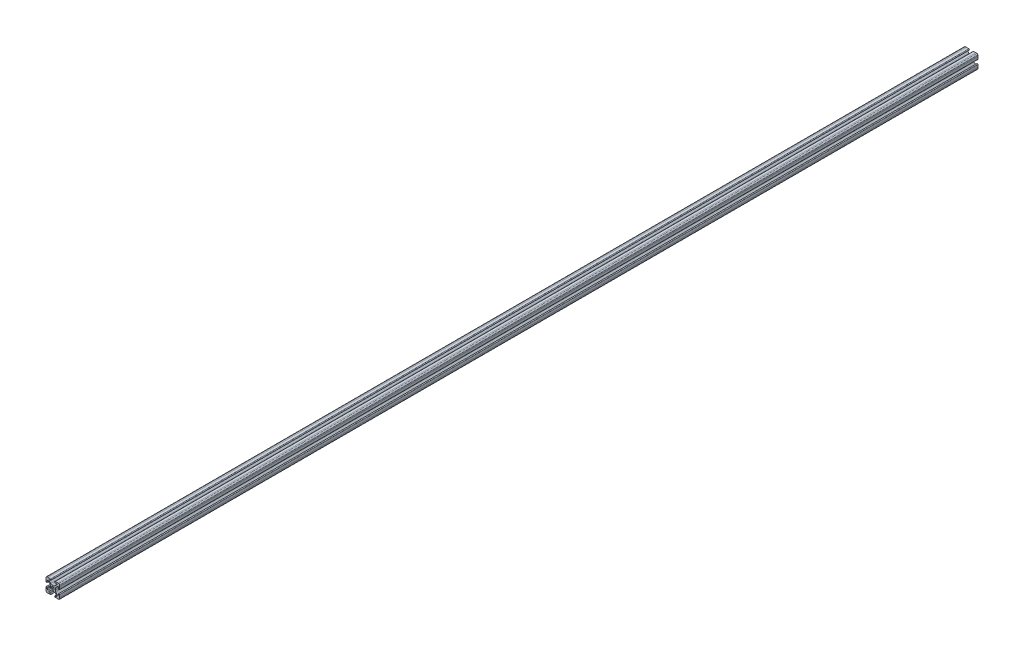
from build123d import *

# Parameters (mm, degrees)
BOSS_EXTRUDE1_DEPTH = 1675.384


with BuildPart() as part:
    # Model → Boss-Extrude1 (new body)
    with BuildSketch(Plane.XY):
        with BuildLine():
            Line((50.659960212, 72.999871414), (53.774553856, 72.999871414))
            ThreePointArc((53.774553856, 72.999871414), (54.989573754, 72.758188929), (56.019617887, 72.069935444))
            Line((56.019617887, 72.069935444), (59.264200891, 68.825352439))
            ThreePointArc((59.264200891, 68.825352439), (59.477513437, 67.701802895), (58.510322513, 67.091550869))
            Line((58.510322513, 67.091550869), (56.572487817, 67.159221548))
            ThreePointArc((56.572487817, 67.159221548), (55.4691069, 66.130302197), (56.498026251, 65.026921279))
            Line((56.498026251, 65.026921279), (60.677257034, 64.880979325))
            Line((60.677257034, 64.880979325), (62.710657034, 64.880979325))
            ThreePointArc((62.710657034, 64.880979325), (64.129537501, 65.468698857), (64.717257034, 66.887579325))
            Line((64.717257034, 66.887579325), (64.717257034, 68.920979325))
            Line((64.717257034, 68.920979325), (64.57131508, 73.100210108))
            ThreePointArc((64.57131508, 73.100210108), (63.467934162, 74.129129459), (62.439014811, 73.025748542))
            Line((62.439014811, 73.025748542), (62.50668549, 71.087913846))
            ThreePointArc((62.50668549, 71.087913846), (61.896433464, 70.120722922), (60.77288392, 70.334035468))
            Line((60.77288392, 70.334035468), (57.528300915, 73.578618472))
            ThreePointArc((57.528300915, 73.578618472), (56.84004743, 74.608662605), (56.598364945, 75.823682503))
            Line((56.598364945, 75.823682503), (56.598364945, 78.938276147))
            ThreePointArc((56.598364945, 78.938276147), (56.84004743, 80.153296044), (57.528300915, 81.183340177))
            Line((57.528300915, 81.183340177), (60.77288392, 84.427923182))
            ThreePointArc((60.77288392, 84.427923182), (61.896433464, 84.641235728), (62.50668549, 83.674044803))
            Line((62.50668549, 83.674044803), (62.439014811, 81.736210108))
            ThreePointArc((62.439014811, 81.736210108), (63.467934162, 80.63282919), (64.57131508, 81.661748542))
            Line((64.57131508, 81.661748542), (64.717257034, 85.840979325))
            Line((64.717257034, 85.840979325), (64.717257034, 87.874379325))
            ThreePointArc((64.717257034, 87.874379325), (64.129537501, 89.293259792), (62.710657034, 89.880979325))
            Line((62.710657034, 89.880979325), (60.677257034, 89.880979325))
            Line((60.677257034, 89.880979325), (56.498026251, 89.73503737))
            ThreePointArc((56.498026251, 89.73503737), (55.4691069, 88.631656452), (56.572487817, 87.602737101))
            Line((56.572487817, 87.602737101), (58.510322513, 87.67040778))
            ThreePointArc((58.510322513, 87.67040778), (59.477513437, 87.060155754), (59.264200891, 85.93660621))
            Line((59.264200891, 85.93660621), (56.019617887, 82.692023205))
            ThreePointArc((56.019617887, 82.692023205), (54.989573754, 82.00376972), (53.774553856, 81.762087236))
            Line((53.774553856, 81.762087236), (50.659960212, 81.762087236))
            ThreePointArc((50.659960212, 81.762087236), (49.444940315, 82.00376972), (48.414896182, 82.692023205))
            Line((48.414896182, 82.692023205), (45.170313177, 85.93660621))
            ThreePointArc((45.170313177, 85.93660621), (44.957000631, 87.060155754), (45.924191556, 87.67040778))
            Line((45.924191556, 87.67040778), (47.862026251, 87.602737101))
            ThreePointArc((47.862026251, 87.602737101), (48.965407169, 88.631656452), (47.936487817, 89.73503737))
            Line((47.936487817, 89.73503737), (43.757257034, 89.880979325))
            Line((43.757257034, 89.880979325), (41.723857034, 89.880979325))
            ThreePointArc((41.723857034, 89.880979325), (40.304976567, 89.293259792), (39.717257034, 87.874379325))
            Line((39.717257034, 87.874379325), (39.717257034, 85.840979325))
            Line((39.717257034, 85.840979325), (39.863198989, 81.661748542))
            ThreePointArc((39.863198989, 81.661748542), (40.966579907, 80.63282919), (41.995499258, 81.736210108))
            Line((41.995499258, 81.736210108), (41.927828579, 83.674044803))
            ThreePointArc((41.927828579, 83.674044803), (42.538080605, 84.641235728), (43.661630149, 84.427923182))
            Line((43.661630149, 84.427923182), (46.906213154, 81.183340177))
            ThreePointArc((46.906213154, 81.183340177), (47.594466639, 80.153296044), (47.836149123, 78.938276147))
            Line((47.836149123, 78.938276147), (47.836149123, 75.823682503))
            ThreePointArc((47.836149123, 75.823682503), (47.594466639, 74.608662605), (46.906213154, 73.578618472))
            Line((46.906213154, 73.578618472), (43.661630149, 70.334035468))
            ThreePointArc((43.661630149, 70.334035468), (42.538080605, 70.120722922), (41.927828579, 71.087913846))
            Line((41.927828579, 71.087913846), (41.995499258, 73.025748542))
            ThreePointArc((41.995499258, 73.025748542), (40.966579907, 74.129129459), (39.863198989, 73.100210108))
            Line((39.863198989, 73.100210108), (39.717257034, 68.920979325))
            Line((39.717257034, 68.920979325), (39.717257034, 66.887579325))
            ThreePointArc((39.717257034, 66.887579325), (40.304976567, 65.468698857), (41.723857034, 64.880979325))
            Line((41.723857034, 64.880979325), (43.757257034, 64.880979325))
            Line((43.757257034, 64.880979325), (47.936487817, 65.026921279))
            ThreePointArc((47.936487817, 65.026921279), (48.965407169, 66.130302197), (47.862026251, 67.159221548))
            Line((47.862026251, 67.159221548), (45.924191556, 67.091550869))
            ThreePointArc((45.924191556, 67.091550869), (44.957000631, 67.701802895), (45.170313177, 68.825352439))
            Line((45.170313177, 68.825352439), (48.414896182, 72.069935444))
            ThreePointArc((48.414896182, 72.069935444), (49.444940315, 72.758188929), (50.659960212, 72.999871414))
        make_face()
        with BuildLine():
            Line((50.64953831, 75.433607249), (50.269884959, 75.433607249))
            Line((50.269884959, 75.433607249), (50.269884959, 75.8132606))
            ThreePointArc((50.269884959, 75.8132606), (53.985023987, 79.148746278), (50.64953831, 75.433607249))
        make_face(mode=Mode.SUBTRACT)
    extrude(amount=BOSS_EXTRUDE1_DEPTH)


solid = part.part
